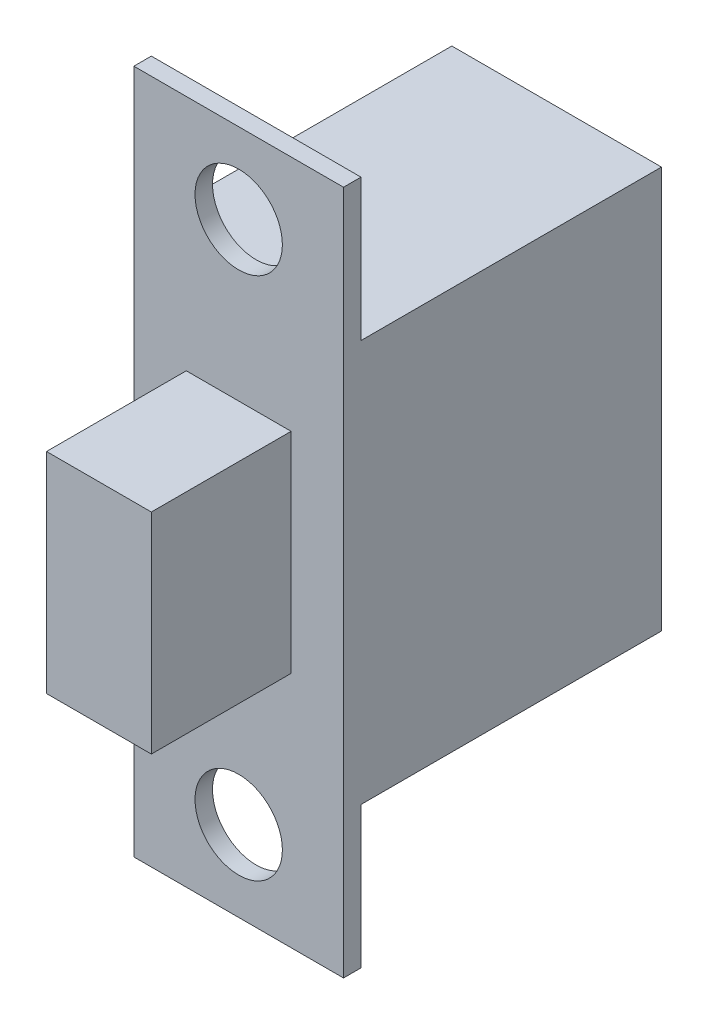
from build123d import *

# Parameters (mm, degrees)
SKETCH1_W           = 6
SKETCH1_H           = 19.6
BOSS_EXTRUDE1_DEPTH = 0.5
SKETCH2_R           = 1.25
CUT_EXTRUDE1_DEPTH  = 1
SKETCH3_W           = 6
SKETCH3_H           = 11.5
BOSS_EXTRUDE2_DEPTH = 9.1
SKETCH6_W           = 3
SKETCH6_H           = 6
BOSS_EXTRUDE3_DEPTH = 4


with BuildPart() as part:
    # Sketch1 → Boss-Extrude1 (new body)
    with BuildSketch(Plane.XY):
        with Locations((21.125833333, 0.952916667)):
            Rectangle(SKETCH1_W, SKETCH1_H)
    extrude(amount=BOSS_EXTRUDE1_DEPTH)

    # Sketch2 → Cut-Extrude1 (cut)
    with BuildSketch(Plane(origin=(0, 0, 0), x_dir=(-1, 0, 0), z_dir=(0, 0, -1))):
        with Locations((-21.125833333, 8.452916667)):
            Circle(SKETCH2_R)
        with Locations((-21.125833333, -6.547083333)):
            Circle(SKETCH2_R)
    extrude(amount=-CUT_EXTRUDE1_DEPTH, mode=Mode.SUBTRACT)



with BuildPart() as body_2:
    # Sketch3 → Boss-Extrude2 (new body)
    with BuildSketch(Plane.XY.offset(0.5)):
        with Locations((21.125833333, 0.952916667)):
            Rectangle(SKETCH3_W, SKETCH3_H)
    extrude(amount=-BOSS_EXTRUDE2_DEPTH)


with BuildPart() as part_1:
    add(part.part)

    add(body_2.part)  # Boss-Extrude3 merges body 2
    # Sketch6 → Boss-Extrude3 (add)
    with BuildSketch(Plane.XY.offset(0.5)):
        with Locations((21.125833333, 0.952916667)):
            Rectangle(SKETCH6_W, SKETCH6_H)
    extrude(amount=BOSS_EXTRUDE3_DEPTH)


solid = part_1.part
